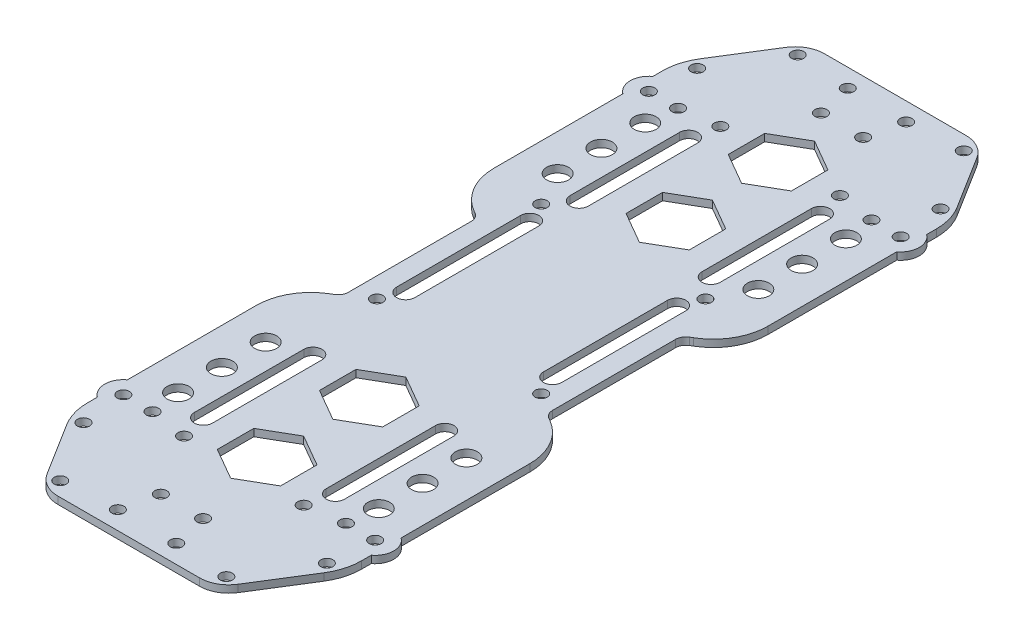
from build123d import *

# Parameters (mm, degrees)
SKETCH1_R           = 3
SKETCH1_R_2         = 1.65
BOSS_EXTRUDE1_DEPTH = 2
BOSS_EXTRUDE2_START = -2
SKETCH2_R           = 5.090936199
SKETCH2_R_2         = 1.65
BOSS_EXTRUDE2_DEPTH = 2
SKETCH5_R           = 1.65
CUT_EXTRUDE1_DEPTH  = 2


with BuildPart() as part:
    # Sketch1 → Boss-Extrude1 (new body)
    with BuildSketch(Plane(origin=(0, 0, 0), x_dir=(1, 0, 0), z_dir=(0, 1, 0))):
        with BuildLine():
            Line((37.525062814, 78.755024886), (37.525062814, 32.634760232))
            ThreePointArc((37.525062814, 32.634760232), (35.515443871, 25.134760232), (30.025062814, 19.644379175))
            Line((30.025062814, 19.644379175), (29.404711739, 19.286219315))
            ThreePointArc((29.404711739, 19.286219315), (28.376391376, 18.257898952), (28, 16.853187212))
            Line((28, 16.853187212), (28, -16.853187212))
            ThreePointArc((28, -16.853187212), (28.376391376, -18.257898952), (29.404711739, -19.286219315))
            Line((29.404711739, -19.286219315), (30.025062814, -19.644379175))
            ThreePointArc((30.025062814, -19.644379175), (35.515443871, -25.134760232), (37.525062814, -32.634760232))
            Line((37.525062814, -32.634760232), (37.525062814, -78.755024886))
            ThreePointArc((37.525062814, -78.755024886), (36.943988254, -82.889585224), (35.245784257, -86.70381385))
            Line((35.245784257, -86.70381385), (26.162970632, -101.239354114))
            ThreePointArc((26.162970632, -101.239354114), (23.257062825, -103.996957657), (19.378585863, -105))
            Line((19.378585863, -105), (-19.378585863, -105))
            ThreePointArc((-19.378585863, -105), (-23.257062825, -103.996957657), (-26.162970632, -101.239354114))
            Line((-26.162970632, -101.239354114), (-35.220721442, -86.743922737))
            ThreePointArc((-35.220721442, -86.743922737), (-36.918925439, -82.929694111), (-37.5, -78.795133774))
            Line((-37.5, -78.795133774), (-37.5, -32.620290209))
            ThreePointArc((-37.5, -32.620290209), (-35.490381057, -25.120290209), (-30, -19.629909152))
            Line((-30, -19.629909152), (-29.404711739, -19.286219315))
            ThreePointArc((-29.404711739, -19.286219315), (-28.376391376, -18.257898952), (-28, -16.853187212))
            Line((-28, -16.853187212), (-28, 16.853187212))
            ThreePointArc((-28, 16.853187212), (-28.376391376, 18.257898952), (-29.404711739, 19.286219315))
            Line((-29.404711739, 19.286219315), (-30, 19.629909152))
            ThreePointArc((-30, 19.629909152), (-35.490381057, 25.120290209), (-37.5, 32.620290209))
            Line((-37.5, 32.620290209), (-37.5, 78.795133774))
            ThreePointArc((-37.5, 78.795133774), (-36.918925439, 82.929694111), (-35.220721442, 86.743922737))
            Line((-35.220721442, 86.743922737), (-26.162970632, 101.239354114))
            ThreePointArc((-26.162970632, 101.239354114), (-23.257062825, 103.996957657), (-19.378585863, 105))
            Line((-19.378585863, 105), (19.378585863, 105))
            ThreePointArc((19.378585863, 105), (23.257062825, 103.996957657), (26.162970632, 101.239354114))
            Line((26.162970632, 101.239354114), (35.245784257, 86.70381385))
            ThreePointArc((35.245784257, 86.70381385), (36.943988254, 82.889585224), (37.525062814, 78.755024886))
        make_face()
        with Locations(Location((-27.497748671, 63.999999894, 0), (0, 0, 270))):
            Circle(SKETCH1_R, mode=Mode.SUBTRACT)
        with Locations(Location((-27.498874335, 51.999999947, 0), (0, 0, 270))):
            Circle(SKETCH1_R, mode=Mode.SUBTRACT)
        with Locations(Location((-27.5, 40, 0), (0, 0, 270))):
            Circle(SKETCH1_R, mode=Mode.SUBTRACT)
        with Locations(Location((27.5, 40, 0), (0, 0, 90))):
            Circle(SKETCH1_R, mode=Mode.SUBTRACT)
        with Locations(Location((27.498874335, 51.999999947, 0), (0, 0, 90))):
            Circle(SKETCH1_R, mode=Mode.SUBTRACT)
        with Locations(Location((27.497748671, 63.999999894, 0), (0, 0, 90))):
            Circle(SKETCH1_R, mode=Mode.SUBTRACT)
        with Locations(Location((27.497748671, -63.999999894, 0), (0, 0, 270))):
            Circle(SKETCH1_R, mode=Mode.SUBTRACT)
        with Locations(Location((27.498874335, -51.999999947, 0), (0, 0, 270))):
            Circle(SKETCH1_R, mode=Mode.SUBTRACT)
        with Locations(Location((27.5, -40, 0), (0, 0, 270))):
            Circle(SKETCH1_R, mode=Mode.SUBTRACT)
        with Locations(Location((-27.5, -40, 0), (0, 0, 90))):
            Circle(SKETCH1_R, mode=Mode.SUBTRACT)
        with Locations(Location((-27.498874335, -51.999999947, 0), (0, 0, 90))):
            Circle(SKETCH1_R, mode=Mode.SUBTRACT)
        with Locations(Location((-27.497748671, -63.999999894, 0), (0, 0, 90))):
            Circle(SKETCH1_R, mode=Mode.SUBTRACT)
        with Locations(Location((-34.497748671, 71.999999894, 0), (0, 0, 270))):
            Circle(SKETCH1_R_2, mode=Mode.SUBTRACT)
        with Locations(Location((34.497748671, 71.999999894, 0), (0, 0, 90))):
            Circle(SKETCH1_R_2, mode=Mode.SUBTRACT)
        with Locations(Location((-34.497748671, -71.999999894, 0), (0, 0, 90))):
            Circle(SKETCH1_R_2, mode=Mode.SUBTRACT)
        with Locations(Location((-22.752839161, 101.035465512, 0), (0, 0, 270))):
            Circle(SKETCH1_R_2, mode=Mode.SUBTRACT)
        with Locations(Location((-33.351224445, 84.074503589, 0), (0, 0, 270))):
            Circle(SKETCH1_R_2, mode=Mode.SUBTRACT)
        with Locations(Location((-5.791877238, 90.437080228, 0), (0, 0, 270))):
            Circle(SKETCH1_R_2, mode=Mode.SUBTRACT)
        with Locations(Location((-16.390262522, 73.476118304, 0), (0, 0, 270))):
            Circle(SKETCH1_R_2, mode=Mode.SUBTRACT)
        with Locations(Location((16.390262522, 73.476118304, 0), (0, 0, 90))):
            Circle(SKETCH1_R_2, mode=Mode.SUBTRACT)
        with Locations(Location((5.791877238, 90.437080228, 0), (0, 0, 90))):
            Circle(SKETCH1_R_2, mode=Mode.SUBTRACT)
        with Locations(Location((33.351224445, 84.074503589, 0), (0, 0, 90))):
            Circle(SKETCH1_R_2, mode=Mode.SUBTRACT)
        with Locations(Location((22.752839161, 101.035465512, 0), (0, 0, 90))):
            Circle(SKETCH1_R_2, mode=Mode.SUBTRACT)
        with Locations(Location((-16.390262522, -73.476118304, 0), (0, 0, 90))):
            Circle(SKETCH1_R_2, mode=Mode.SUBTRACT)
        with Locations(Location((16.390262522, -73.476118304, 0), (0, 0, 270))):
            Circle(SKETCH1_R_2, mode=Mode.SUBTRACT)
        with Locations(Location((22.752839161, -101.035465512, 0), (0, 0, 270))):
            Circle(SKETCH1_R_2, mode=Mode.SUBTRACT)
        with Locations(Location((33.351224445, -84.074503589, 0), (0, 0, 270))):
            Circle(SKETCH1_R_2, mode=Mode.SUBTRACT)
        with Locations(Location((5.791877238, -90.437080228, 0), (0, 0, 270))):
            Circle(SKETCH1_R_2, mode=Mode.SUBTRACT)
        with Locations(Location((-5.791877238, -90.437080228, 0), (0, 0, 90))):
            Circle(SKETCH1_R_2, mode=Mode.SUBTRACT)
        with Locations(Location((-33.351224445, -84.074503589, 0), (0, 0, 90))):
            Circle(SKETCH1_R_2, mode=Mode.SUBTRACT)
        with Locations(Location((-22.752839161, -101.035465512, 0), (0, 0, 90))):
            Circle(SKETCH1_R_2, mode=Mode.SUBTRACT)
        with Locations(Location((34.497748671, -71.999999894, 0), (0, 0, 270))):
            Circle(SKETCH1_R_2, mode=Mode.SUBTRACT)
    extrude(amount=BOSS_EXTRUDE1_DEPTH)

    # Sketch2 → Boss-Extrude2 (add)
    # profile 1 of 4: a face of its own
    with BuildSketch(Plane(origin=(0, 2, 0), x_dir=(1, 0, 0), z_dir=(0, 1, 0)).offset(BOSS_EXTRUDE2_START)):
        with Locations((-34.497748671, 71.999999894)):
            Circle(SKETCH2_R)
        with Locations(Location((-34.497748671, 71.999999894, 0), (0, 0, 270))):
            Circle(SKETCH2_R_2, mode=Mode.SUBTRACT)
    # profile 2 of 4: a face of its own
    with BuildSketch(Plane(origin=(0, 2, 0), x_dir=(1, 0, 0), z_dir=(0, 1, 0)).offset(BOSS_EXTRUDE2_START)):
        with Locations((34.497748671, 71.999999894)):
            Circle(SKETCH2_R)
        with Locations(Location((34.497748671, 71.999999894, 0), (0, 0, 90))):
            Circle(SKETCH2_R_2, mode=Mode.SUBTRACT)
    # profile 3 of 4: a face of its own
    with BuildSketch(Plane(origin=(0, 2, 0), x_dir=(1, 0, 0), z_dir=(0, 1, 0)).offset(BOSS_EXTRUDE2_START)):
        with Locations((34.497748671, -71.999999894)):
            Circle(SKETCH2_R)
        with Locations(Location((34.497748671, -71.999999894, 0), (0, 0, 270))):
            Circle(SKETCH2_R_2, mode=Mode.SUBTRACT)
    # profile 4 of 4: a face of its own
    with BuildSketch(Plane(origin=(0, 2, 0), x_dir=(1, 0, 0), z_dir=(0, 1, 0)).offset(BOSS_EXTRUDE2_START)):
        with Locations((-34.497748671, -71.999999894)):
            Circle(SKETCH2_R)
        with Locations(Location((-34.497748671, -71.999999894, 0), (0, 0, 90))):
            Circle(SKETCH2_R_2, mode=Mode.SUBTRACT)
    extrude(amount=BOSS_EXTRUDE2_DEPTH)

    # Sketch5 → Cut-Extrude1 (cut)
    with BuildSketch(Plane(origin=(0, 2, 0), x_dir=(1, 0, 0), z_dir=(0, 1, 0))):
        with Locations(Location((-26.497748671, 71.999999894, 0), (0, 0, 270))):
            Circle(SKETCH5_R)
        with Locations(Location((-8, 100, 0), (0, 0, 270))):
            Circle(SKETCH5_R)
        with Locations(Location((8, 100, 0), (0, 0, 90))):
            Circle(SKETCH5_R)
        with Locations(Location((26.497748671, 71.999999894, 0), (0, 0, 90))):
            Circle(SKETCH5_R)
        with Locations(Location((26.497748671, -71.999999894, 0), (0, 0, 270))):
            Circle(SKETCH5_R)
        with Locations(Location((8, -100, 0), (0, 0, 270))):
            Circle(SKETCH5_R)
        with Locations(Location((-8, -100, 0), (0, 0, 90))):
            Circle(SKETCH5_R)
        with Locations(Location((-26.497748671, -71.999999894, 0), (0, 0, 90))):
            Circle(SKETCH5_R)
        with Locations(Location((-22.5, 30.5, 0), (0, 0, 270))):
            Circle(SKETCH5_R)
        with Locations(Location((22.5, 30.5, 0), (0, 0, 270))):
            Circle(SKETCH5_R)
        with Locations(Location((-22.5, -14.5, 0), (0, 0, 270))):
            Circle(SKETCH5_R)
        with Locations(Location((22.5, -14.5, 0), (0, 0, 270))):
            Circle(SKETCH5_R)
        with BuildLine():
            Line((-15.574688151, 66.481947499), (-15.574688151, 36.481947499))
            ThreePointArc((-15.574688151, 36.481947499), (-18.074688151, 33.981947499), (-20.574688151, 36.481947499))
            Line((-20.574688151, 36.481947499), (-20.574688151, 66.481947499))
            ThreePointArc((-20.574688151, 66.481947499), (-18.074688151, 68.981947499), (-15.574688151, 66.481947499))
        make_face()
        with BuildLine():
            Line((-17.63046279, 25), (-17.63046279, -9))
            ThreePointArc((-17.63046279, -9), (-20.13046279, -11.5), (-22.63046279, -9))
            Line((-22.63046279, -9), (-22.63046279, 25))
            ThreePointArc((-22.63046279, 25), (-20.13046279, 27.5), (-17.63046279, 25))
        make_face()
        with BuildLine():
            Line((17.63046279, 25), (17.63046279, -9))
            ThreePointArc((17.63046279, -9), (20.13046279, -11.5), (22.63046279, -9))
            Line((22.63046279, -9), (22.63046279, 25))
            ThreePointArc((22.63046279, 25), (20.13046279, 27.5), (17.63046279, 25))
        make_face()
        with BuildLine():
            Line((15.574688151, 66.481947499), (15.574688151, 36.481947499))
            ThreePointArc((15.574688151, 36.481947499), (18.074688151, 33.981947499), (20.574688151, 36.481947499))
            Line((20.574688151, 36.481947499), (20.574688151, 66.481947499))
            ThreePointArc((20.574688151, 66.481947499), (18.074688151, 68.981947499), (15.574688151, 66.481947499))
        make_face()
        with BuildLine():
            Line((15.574688151, -66.481947499), (15.574688151, -36.481947499))
            ThreePointArc((15.574688151, -36.481947499), (18.074688151, -33.981947499), (20.574688151, -36.481947499))
            Line((20.574688151, -36.481947499), (20.574688151, -66.481947499))
            ThreePointArc((20.574688151, -66.481947499), (18.074688151, -68.981947499), (15.574688151, -66.481947499))
        make_face()
        with BuildLine():
            Line((-15.574688151, -66.481947499), (-15.574688151, -36.481947499))
            ThreePointArc((-15.574688151, -36.481947499), (-18.074688151, -33.981947499), (-20.574688151, -36.481947499))
            Line((-20.574688151, -36.481947499), (-20.574688151, -66.481947499))
            ThreePointArc((-20.574688151, -66.481947499), (-18.074688151, -68.981947499), (-15.574688151, -66.481947499))
        make_face()
        Polygon((8.660254038, 49.909485966), (0, 54.909485966), (-8.660254038, 49.909485966), (-8.660254038, 39.909485966), (0, 34.909485966), (8.660254038, 39.909485966), align=None)
        Polygon((8.660254038, -44.090514034), (8.660254038, -34.090514034), (0, -29.090514034), (-8.660254038, -34.090514034), (-8.660254038, -44.090514034), (0, -49.090514034), align=None)
        Polygon((0, 62.909485966), (8.660254038, 67.909485966), (8.660254038, 77.909485966), (0, 82.909485966), (-8.660254038, 77.909485966), (-8.660254038, 67.909485966), align=None)
        Polygon((8.660254038, -62.090514034), (0, -57.090514034), (-8.660254038, -62.090514034), (-8.660254038, -72.090514034), (0, -77.090514034), (8.660254038, -72.090514034), align=None)
    extrude(amount=-CUT_EXTRUDE1_DEPTH, mode=Mode.SUBTRACT)


solid = part.part
